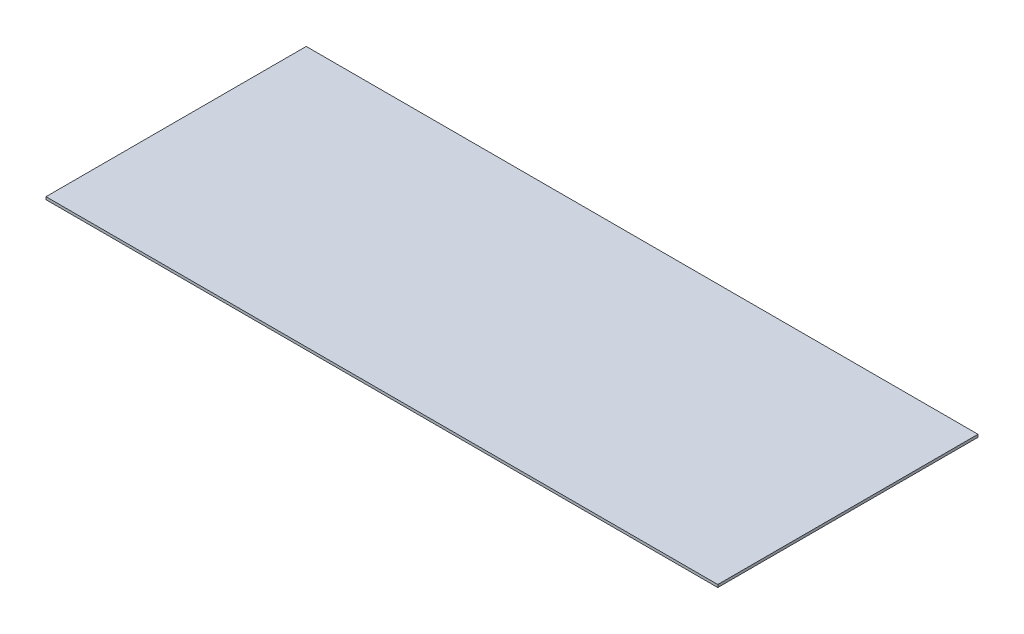
from build123d import *

# Parameters (mm, degrees)
BOSS_EXTRUDE1_DEPTH      = 58.42
BOSS_EXTRUDE1_DEPTH_BACK = 58.42
SKETCH3_W                = 301.625
SKETCH3_H                = 1.1938


with BuildPart() as part:
    # Sketch3 → Boss-Extrude1 (new, two sides: drawn at the far end of the back side and taken through both)
    with BuildSketch(Plane.XY.offset(-BOSS_EXTRUDE1_DEPTH_BACK)):
        Rectangle(SKETCH3_W, SKETCH3_H)
    extrude(amount=BOSS_EXTRUDE1_DEPTH + BOSS_EXTRUDE1_DEPTH_BACK)


solid = part.part
